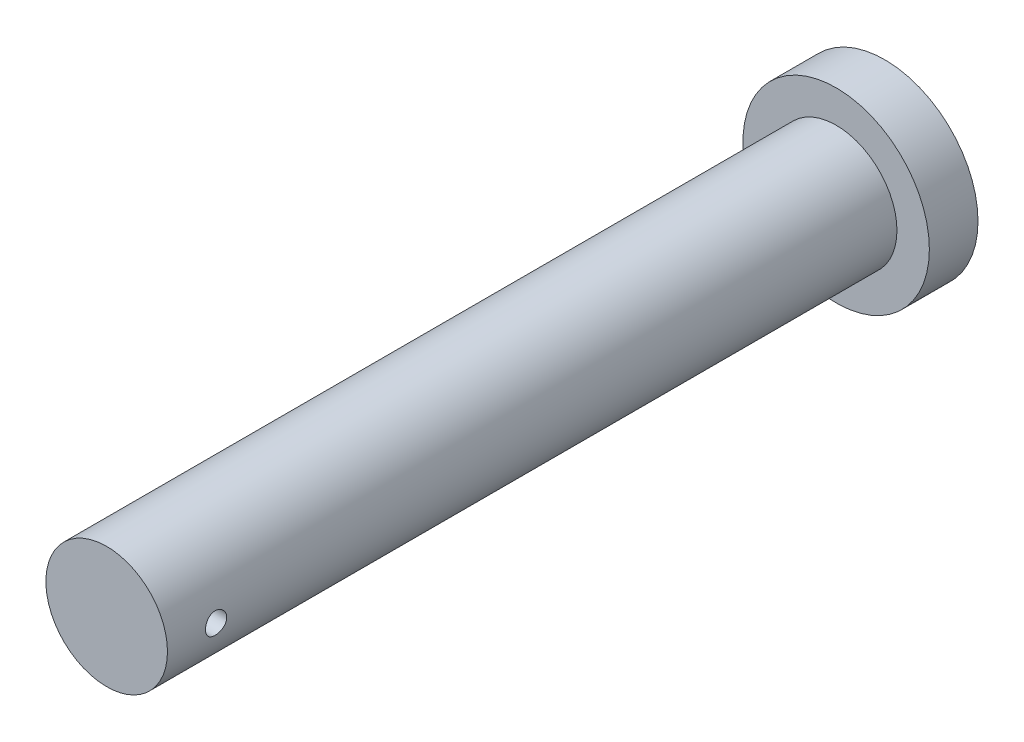
from build123d import *

# Parameters (mm, degrees)
SKETCH2_R           = 23
BOSS_EXTRUDE1_DEPTH = 12
SKETCH3_R           = 15
BOSS_EXTRUDE2_DEPTH = 180
SCALE1_SCALE        = 0.3


with BuildPart() as part:
    # Sketch2 → Boss-Extrude1 (new body)
    with BuildSketch(Plane.XY):
        Circle(SKETCH2_R)
    extrude(amount=BOSS_EXTRUDE1_DEPTH)

    # Sketch3 → Boss-Extrude2 (add)
    with BuildSketch(Plane.XY.offset(12)):
        with Locations(Location((0, 0, 0), (0, 0, 180))):
            Circle(SKETCH3_R)
    extrude(amount=BOSS_EXTRUDE2_DEPTH)

    # Sketch4 → Cut-Revolve1 (revolve, cut)
    with BuildSketch(Plane.XY.offset(180), mode=Mode.PRIVATE) as cut_revolve1_sk:
        Polygon((-30, 0), (-30, 3), (30, 2.5), (30, 0), align=None)
    revolve(cut_revolve1_sk.sketch.rotate(Axis((30, 0, 180), (-1, 0, 0)), 137.024045149), axis=Axis((30, 0, 180), (-1, 0, 0)), mode=Mode.SUBTRACT)


with BuildPart() as part_1:
    # Scale1: scaled about (0.002156445, -4e-08, 88.550522263)
    add(part.part.scale(SCALE1_SCALE).moved(Location((0.001509511, -2.8e-08, 61.985365584))))


solid = part_1.part
